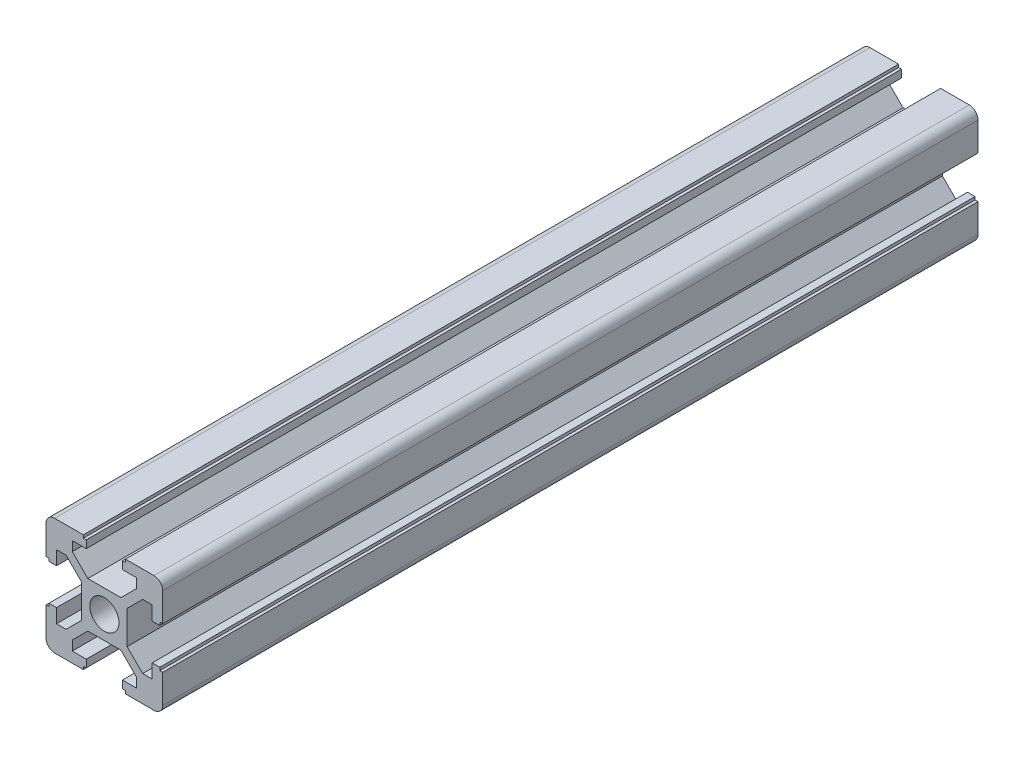
from build123d import *

# Parameters (mm, degrees)
SKETCH1_R           = 2.5
BOSS_EXTRUDE1_DEPTH = 139.7


with BuildPart() as part:
    # Sketch1 → Boss-Extrude1 (new body)
    with BuildSketch(Plane.XY):
        with BuildLine():
            Line((-10, -3.6), (-10, -8.5))
            ThreePointArc((-10, -8.5), (-9.560660172, -9.560660172), (-8.5, -10))
            Line((-8.5, -10), (-3.6, -10))
            Line((-3.6, -10), (-3.6, -9.5))
            Line((-3.6, -9.5), (-3.1, -9.5))
            Line((-3.1, -9.5), (-3.1, -8.2))
            Line((-3.1, -8.2), (-5.5, -8.2))
            Line((-5.5, -8.2), (-5.5, -6.560660172))
            Line((-5.5, -6.560660172), (-2.839339828, -3.9))
            Line((-2.839339828, -3.9), (0, -3.9))
            Line((0, -3.9), (2.839339828, -3.9))
            Line((2.839339828, -3.9), (5.5, -6.560660172))
            Line((5.5, -6.560660172), (5.5, -8.2))
            Line((5.5, -8.2), (3.1, -8.2))
            Line((3.1, -8.2), (3.1, -9.5))
            Line((3.1, -9.5), (3.6, -9.5))
            Line((3.6, -9.5), (3.6, -10))
            Line((3.6, -10), (8.5, -10))
            ThreePointArc((8.5, -10), (9.560660172, -9.560660172), (10, -8.5))
            Line((10, -8.5), (10, -3.6))
            Line((10, -3.6), (9.5, -3.6))
            Line((9.5, -3.6), (9.5, -3.1))
            Line((9.5, -3.1), (8.2, -3.1))
            Line((8.2, -3.1), (8.2, -5.5))
            Line((8.2, -5.5), (6.560660172, -5.5))
            Line((6.560660172, -5.5), (3.9, -2.839339828))
            Line((3.9, -2.839339828), (3.9, 2.839339828))
            Line((3.9, 2.839339828), (6.560660172, 5.5))
            Line((6.560660172, 5.5), (8.2, 5.5))
            Line((8.2, 5.5), (8.2, 3.1))
            Line((8.2, 3.1), (9.5, 3.1))
            Line((9.5, 3.1), (9.5, 3.6))
            Line((9.5, 3.6), (10, 3.6))
            Line((10, 3.6), (10, 8.5))
            ThreePointArc((10, 8.5), (9.560660172, 9.560660172), (8.5, 10))
            Line((8.5, 10), (3.6, 10))
            Line((3.6, 10), (3.6, 9.5))
            Line((3.6, 9.5), (3.1, 9.5))
            Line((3.1, 9.5), (3.1, 8.2))
            Line((3.1, 8.2), (5.5, 8.2))
            Line((5.5, 8.2), (5.5, 6.560660172))
            Line((5.5, 6.560660172), (2.839339828, 3.9))
            Line((2.839339828, 3.9), (0, 3.9))
            Line((0, 3.9), (-2.839339828, 3.9))
            Line((-2.839339828, 3.9), (-5.5, 6.560660172))
            Line((-5.5, 6.560660172), (-5.5, 8.2))
            Line((-5.5, 8.2), (-3.1, 8.2))
            Line((-3.1, 8.2), (-3.1, 9.5))
            Line((-3.1, 9.5), (-3.6, 9.5))
            Line((-3.6, 9.5), (-3.6, 10))
            Line((-3.6, 10), (-8.5, 10))
            ThreePointArc((-8.5, 10), (-9.560660172, 9.560660172), (-10, 8.5))
            Line((-10, 8.5), (-10, 3.6))
            Line((-10, 3.6), (-9.5, 3.6))
            Line((-9.5, 3.6), (-9.5, 3.1))
            Line((-9.5, 3.1), (-8.2, 3.1))
            Line((-8.2, 3.1), (-8.2, 5.5))
            Line((-8.2, 5.5), (-6.560660172, 5.5))
            Line((-6.560660172, 5.5), (-3.9, 2.839339828))
            Line((-3.9, 2.839339828), (-3.9, -2.839339828))
            Line((-3.9, -2.839339828), (-6.560660172, -5.5))
            Line((-6.560660172, -5.5), (-8.2, -5.5))
            Line((-8.2, -5.5), (-8.2, -3.1))
            Line((-8.2, -3.1), (-9.5, -3.1))
            Line((-9.5, -3.1), (-9.5, -3.6))
            Line((-9.5, -3.6), (-10, -3.6))
        make_face()
        Circle(SKETCH1_R, mode=Mode.SUBTRACT)
    extrude(amount=BOSS_EXTRUDE1_DEPTH)


solid = part.part
